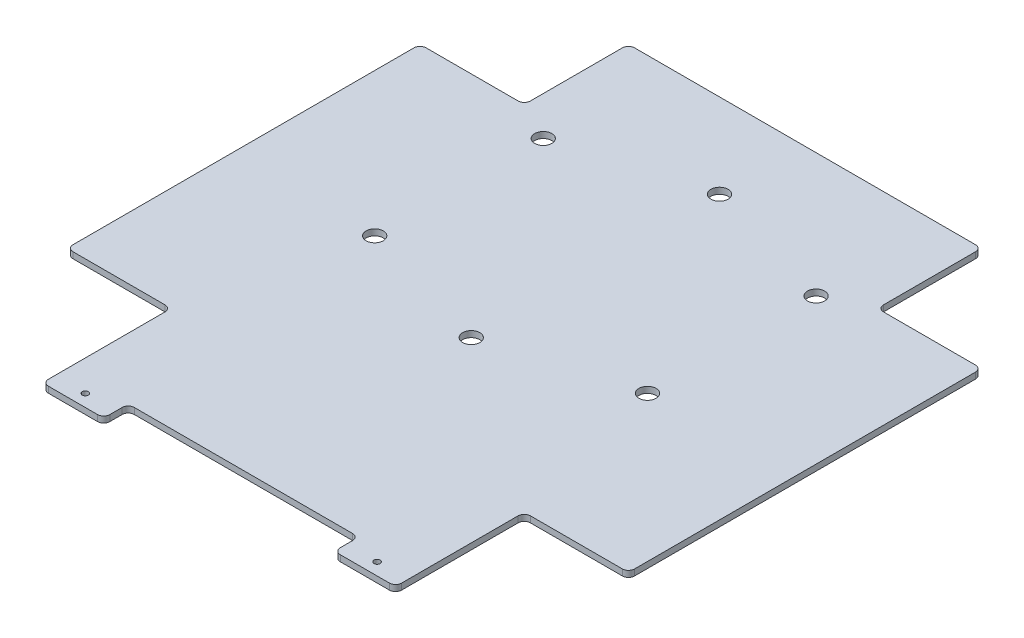
from build123d import *

# Parameters (mm, degrees)
SKETCH1_W                    = 458
SKETCH1_H                    = 458
BOSS_EXTRUDE1_DEPTH          = 5
SKETCH2_W                    = 85
SKETCH2_H                    = 85
CUT_EXTRUDE1_DEPTH           = 324.893501015
SKETCH4_W                    = 50
SKETCH4_H                    = 20
BOSS_EXTRUDE2_DEPTH          = 5
FILLET1_R                    = 5
FILLET2_R                    = 5
F_5_0_5_DIAMETER_HOLE1_D     = 5
F_5_0_5_DIAMETER_HOLE1_DEPTH = 38
F_5_0_5_DIAMETER_HOLE1_TIP   = 1.502151548
F_14_0_14_DIAMETER_HOLE1_D   = 14


with BuildPart() as part:
    # Sketch1 → Boss-Extrude1 (new body)
    with BuildSketch(Plane(origin=(0, 0, 0), x_dir=(1, 0, 0), z_dir=(0, 1, 0))):
        Rectangle(SKETCH1_W, SKETCH1_H)
    extrude(amount=BOSS_EXTRUDE1_DEPTH)

    # Sketch2 → Cut-Extrude1 (cut, through all)
    with BuildSketch(Plane(origin=(0, 5, 0), x_dir=(1, 0, 0), z_dir=(0, 1, 0))):
        with Locations((-186.5, 186.5)):
            Rectangle(SKETCH2_W, SKETCH2_H)
        with Locations((186.5, 186.5)):
            Rectangle(SKETCH2_W, SKETCH2_H)
        with Locations((186.5, -186.5)):
            Rectangle(SKETCH2_W, SKETCH2_H)
        with Locations((-186.5, -186.5)):
            Rectangle(SKETCH2_W, SKETCH2_H)
    extrude(amount=-CUT_EXTRUDE1_DEPTH, mode=Mode.SUBTRACT)

    # Sketch4 → Boss-Extrude2 (add)
    with BuildSketch(Plane(origin=(0, 5, 0), x_dir=(1, 0, 0), z_dir=(0, 1, 0))):
        with Locations((-119, -239)):
            Rectangle(SKETCH4_W, SKETCH4_H)
        with Locations((119, -239)):
            Rectangle(SKETCH4_W, SKETCH4_H)
    extrude(amount=-BOSS_EXTRUDE2_DEPTH)

    # Fillet1
    fillet1_edges = [part.edges().sort_by_distance(p)[0] for p in [
        (-144, 2.5, 144),
        (144, 2.5, 144),
        (144, 2.5, -144),
        (-144, 2.5, -144),
        (-94, 2.5, 229),
        (94, 2.5, 229),
    ]]
    fillet(fillet1_edges, radius=FILLET1_R)

    # Fillet2
    fillet2_edges = [part.edges().sort_by_distance(p)[0] for p in [
        (-229, 2.5, 144),
        (229, 2.5, 144),
        (229, 2.5, -144),
        (144, 2.5, -229),
        (-229, 2.5, -144),
        (-144, 2.5, -229),
        (-144, 2.5, 249),
        (-94, 2.5, 249),
        (144, 2.5, 249),
        (94, 2.5, 249),
    ]]
    fillet(fillet2_edges, radius=FILLET2_R)

    # Ø5.0 (5) Diameter Hole1
    with Locations(Plane(origin=(0, 5, 0), x_dir=(1, 0, 0), z_dir=(0, 1, 0))):
        with Locations((-119, -239), (119, -239)):
            Hole(F_5_0_5_DIAMETER_HOLE1_D / 2, depth=F_5_0_5_DIAMETER_HOLE1_DEPTH)
            with Locations((0, 0, -(F_5_0_5_DIAMETER_HOLE1_DEPTH + F_5_0_5_DIAMETER_HOLE1_TIP / 2))):  # 118° drill point
                Cone(0, F_5_0_5_DIAMETER_HOLE1_D / 2, F_5_0_5_DIAMETER_HOLE1_TIP, mode=Mode.SUBTRACT)

    # Ø14.0 (14) Diameter Hole1 (through all)
    with Locations(Plane(origin=(0, 0, 0), x_dir=(-1, 0, 0), z_dir=(0, -1, 0))):
        with Locations((112.25, 127.75), (112.25, -9.75), (1, 160.25), (-110.25, 127.75), (-110.25, -9.75), (1, -42.25)):
            Hole(F_14_0_14_DIAMETER_HOLE1_D / 2)


solid = part.part
